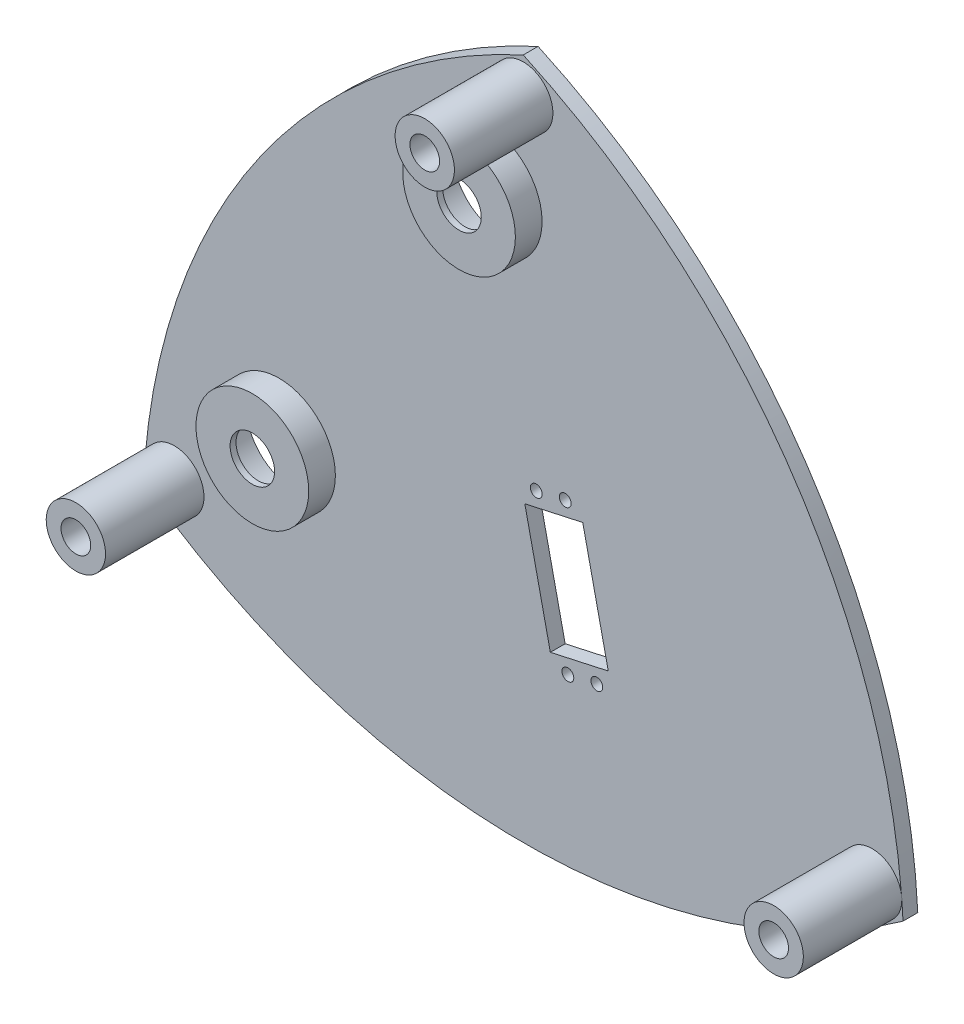
from build123d import *

# Parameters (mm, degrees)
SKETCH_1_R          = 5
EXTRUDE_1_DEPTH     = 5
SKETCH_2_R          = 10
SKETCH_2_R_2        = 5
EXTRUDE_2_DEPTH     = 33.2
SKETCH_8_R          = 16
CUT_EXTRUDE_4_DEPTH = 15
SKETCH_9_R          = 19
SKETCH_9_R_2        = 16
EXTRUDE_3_DEPTH     = 9
EXTRUDE_START       = -2
SKETCH_10_R         = 19
SKETCH_10_R_2       = 7.5
EXTRUDE_4_DEPTH     = 2
CUT_EXTRUDE_5_DEPTH = 10
SKETCH_12_R         = 2
CUT_EXTRUDE_6_DEPTH = 10


with BuildPart() as part:
    # 草图1 → 凸台-拉伸1 (new body)
    with BuildSketch(Plane.XY):
        with BuildLine():
            ThreePointArc((-128.022678922, -73.913928138), (-90.421378279, 38.440519474), (0, 115))
            ThreePointArc((0, 115), (90.421378279, 38.440519474), (128.022678922, -73.913928138))
            ThreePointArc((128.022678922, -73.913928138), (0, -115), (-128.022678922, -73.913928138))
        make_face()
        with Locations((0, 103)):
            Circle(SKETCH_1_R, mode=Mode.SUBTRACT)
        with Locations((-117.630374076, -67.913928138)):
            Circle(SKETCH_1_R, mode=Mode.SUBTRACT)
        with Locations((117.630374076, -67.913928138)):
            Circle(SKETCH_1_R, mode=Mode.SUBTRACT)
    extrude(amount=EXTRUDE_1_DEPTH)

    # 草图2 → 凸台-拉伸2 (add)
    # profile 1 of 3: a face of its own
    with BuildSketch(Plane.XY.offset(5)):
        with Locations(Location((0, 103, 0), (0, 0, 180))):
            Circle(SKETCH_2_R)
        with Locations((0, 103)):
            Circle(SKETCH_2_R_2, mode=Mode.SUBTRACT)
    # profile 2 of 3: a face of its own
    with BuildSketch(Plane.XY.offset(5)):
        with Locations(Location((-117.630374076, -67.913928138, 0), (0, 0, 179.375778052))):
            Circle(SKETCH_2_R)
        with Locations((-117.630374076, -67.913928138)):
            Circle(SKETCH_2_R_2, mode=Mode.SUBTRACT)
    # profile 3 of 3: a face of its own
    with BuildSketch(Plane.XY.offset(5)):
        with Locations(Location((117.630374076, -67.913928138, 0), (0, 0, 8.696571879))):
            Circle(SKETCH_2_R)
        with Locations((117.630374076, -67.913928138)):
            Circle(SKETCH_2_R_2, mode=Mode.SUBTRACT)
    extrude(amount=EXTRUDE_2_DEPTH)

    # 草图8 → 切除-拉伸4 (cut)
    with BuildSketch(Plane(origin=(0, 0, 0), x_dir=(-1, 0, 0), z_dir=(0, 0, -1))):
        with Locations((82.334125615, -39.530718783)):
            Circle(SKETCH_8_R)
        with Locations((12.650995066, 69.515536741)):
            Circle(SKETCH_8_R)
    extrude(amount=-CUT_EXTRUDE_4_DEPTH, mode=Mode.SUBTRACT)

    # 草图9 → 凸台-拉伸3 (add)
    # profile 1 of 2: a face of its own
    with BuildSketch(Plane.XY.offset(5)):
        with Locations((-82.334125615, -39.530718783)):
            Circle(SKETCH_9_R)
        with Locations(Location((-82.334125615, -39.530718783, 0), (0, 0, 180))):
            Circle(SKETCH_9_R_2, mode=Mode.SUBTRACT)
    # profile 2 of 2: a face of its own
    with BuildSketch(Plane.XY.offset(5)):
        with Locations((-12.650995066, 69.515536741)):
            Circle(SKETCH_9_R)
        with Locations(Location((-12.650995066, 69.515536741, 0), (0, 0, 180))):
            Circle(SKETCH_9_R_2, mode=Mode.SUBTRACT)
    extrude(amount=EXTRUDE_3_DEPTH)

    # 草图10 → 凸台-拉伸4 (add)
    # profile 1 of 2: a face of its own
    with BuildSketch(Plane.XY.offset(14).offset(EXTRUDE_START)):
        with Locations((-82.334125615, -39.530718783)):
            Circle(SKETCH_10_R)
        with Locations((-82.334125615, -39.530718783)):
            Circle(SKETCH_10_R_2, mode=Mode.SUBTRACT)
    # profile 2 of 2: a face of its own
    with BuildSketch(Plane.XY.offset(14).offset(EXTRUDE_START)):
        with Locations((-12.650995066, 69.515536741)):
            Circle(SKETCH_10_R)
        with Locations((-12.650995066, 69.515536741)):
            Circle(SKETCH_10_R_2, mode=Mode.SUBTRACT)
    extrude(amount=EXTRUDE_4_DEPTH)

    # 草图11 → 切除-拉伸5 (cut)
    with BuildSketch(Plane(origin=(0, 0, 0), x_dir=(-1, 0, 0), z_dir=(0, 0, -1))):
        Polygon((-9.136952782, -54.845169507), (-28.668863324, -50.543487212), (-20.065498734, -11.479666127), (-0.533588192, -15.781348422), align=None)
    extrude(amount=-CUT_EXTRUDE_5_DEPTH, mode=Mode.SUBTRACT)

    # 草图12 → 切除-拉伸6 (cut)
    with BuildSketch(Plane.XY.offset(5)):
        with Locations((15.041579962, -58.408577687)):
            Circle(SKETCH_12_R)
        with Locations((24.807535234, -56.257736539)):
            Circle(SKETCH_12_R)
        with Locations((4.394916282, -10.067099095)):
            Circle(SKETCH_12_R)
        with Locations((14.160871553, -7.916257947)):
            Circle(SKETCH_12_R)
    extrude(amount=-CUT_EXTRUDE_6_DEPTH, mode=Mode.SUBTRACT)


solid = part.part
